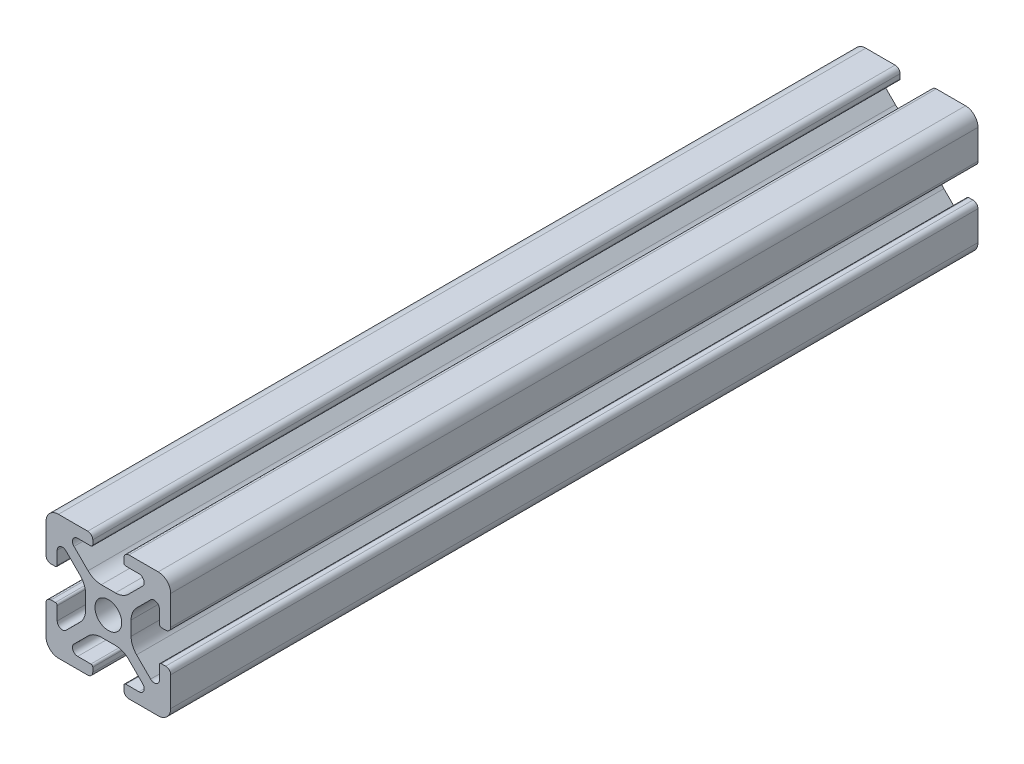
from build123d import *

# Parameters (mm, degrees)
BOSS_EXTRU_1_DEPTH = 129.5


with BuildPart() as part:
    # Esquisse1 → Boss.-Extru.1 (new body)
    with BuildSketch(Plane.XY):
        with BuildLine():
            Line((-3.255887446, 4.528679645), (-5.506192286, 6.778984485))
            ThreePointArc((-5.506192286, 6.778984485), (-5.686636441, 7.686138511), (-4.917588391, 8.199999989))
            Line((-4.917588391, 8.199999989), (-2.799999991, 8.199999989))
            ThreePointArc((-2.799999991, 8.199999989), (-2.587867957, 8.287867955), (-2.499999991, 8.499999989))
            Line((-2.499999991, 8.499999989), (-2.499999991, 9.199999989))
            ThreePointArc((-2.499999991, 9.199999989), (-2.734314566, 9.765685414), (-3.299999991, 9.999999989))
            Line((-3.299999991, 9.999999989), (-7.999999991, 9.999999989))
            ThreePointArc((-7.999999991, 9.999999989), (-9.414213554, 9.414213552), (-9.999999991, 7.999999989))
            Line((-9.999999991, 7.999999989), (-9.999999991, 3.299999989))
            ThreePointArc((-9.999999991, 3.299999989), (-9.765685416, 2.734314564), (-9.199999991, 2.499999989))
            Line((-9.199999991, 2.499999989), (-8.499999991, 2.499999989))
            ThreePointArc((-8.499999991, 2.499999989), (-8.287867957, 2.587867955), (-8.199999991, 2.799999989))
            Line((-8.199999991, 2.799999989), (-8.199999991, 4.917588389))
            ThreePointArc((-8.199999991, 4.917588389), (-7.686138517, 5.686636433), (-6.778984497, 5.506192279))
            Line((-6.778984497, 5.506192279), (-4.528679657, 3.255887439))
            ThreePointArc((-4.528679657, 3.255887439), (-3.878361403, 2.282617393), (-3.650000001, 1.134567096))
            Line((-3.650000001, 1.134567096), (-3.650000001, -1.134567114))
            ThreePointArc((-3.650000001, -1.134567114), (-3.878361403, -2.282617409), (-4.528679656, -3.255887454))
            Line((-4.528679656, -3.255887454), (-6.778984496, -5.506192294))
            ThreePointArc((-6.778984496, -5.506192294), (-7.686138522, -5.686636449), (-8.2, -4.9175884))
            Line((-8.2, -4.9175884), (-8.2, -2.8))
            ThreePointArc((-8.2, -2.8), (-8.287867966, -2.587867966), (-8.5, -2.5))
            Line((-8.5, -2.5), (-9.2, -2.5))
            ThreePointArc((-9.2, -2.5), (-9.765685425, -2.734314575), (-10, -3.3))
            Line((-10, -3.3), (-10, -8))
            ThreePointArc((-10, -8), (-9.414213562, -9.414213562), (-8, -10))
            Line((-8, -10), (-3.3, -10))
            ThreePointArc((-3.3, -10), (-2.734314575, -9.765685425), (-2.5, -9.2))
            Line((-2.5, -9.2), (-2.5, -8.5))
            ThreePointArc((-2.5, -8.5), (-2.587867966, -8.287867966), (-2.8, -8.2))
            Line((-2.8, -8.2), (-4.9175884, -8.2))
            ThreePointArc((-4.9175884, -8.2), (-5.686636444, -7.686138526), (-5.50619229, -6.778984506))
            Line((-5.50619229, -6.778984506), (-3.25588745, -4.528679666))
            ThreePointArc((-3.25588745, -4.528679666), (-2.282617404, -3.878361412), (-1.134567106, -3.650000009))
            Line((-1.134567106, -3.650000009), (1.134567104, -3.650000009))
            ThreePointArc((1.134567104, -3.650000009), (2.282617399, -3.878361412), (3.255887444, -4.528679664))
            Line((3.255887444, -4.528679664), (5.506192284, -6.778984504))
            ThreePointArc((5.506192284, -6.778984504), (5.686636439, -7.686138531), (4.917588389, -8.200000009))
            Line((4.917588389, -8.200000009), (2.799999989, -8.200000009))
            ThreePointArc((2.799999989, -8.200000009), (2.587867955, -8.287867974), (2.499999989, -8.500000009))
            Line((2.499999989, -8.500000009), (2.499999989, -9.200000009))
            ThreePointArc((2.499999989, -9.200000009), (2.734314564, -9.765685434), (3.299999989, -10.000000009))
            Line((3.299999989, -10.000000009), (7.999999989, -10.000000009))
            ThreePointArc((7.999999989, -10.000000009), (9.414213552, -9.414213571), (9.999999989, -8.000000009))
            Line((9.999999989, -8.000000009), (9.999999989, -3.300000009))
            ThreePointArc((9.999999989, -3.300000009), (9.765685414, -2.734314584), (9.199999989, -2.500000009))
            Line((9.199999989, -2.500000009), (8.499999989, -2.500000009))
            ThreePointArc((8.499999989, -2.500000009), (8.287867955, -2.587867974), (8.199999989, -2.800000009))
            Line((8.199999989, -2.800000009), (8.199999989, -4.917588409))
            ThreePointArc((8.199999989, -4.917588409), (7.686138515, -5.686636452), (6.778984495, -5.506192299))
            Line((6.778984495, -5.506192299), (4.528679655, -3.255887459))
            ThreePointArc((4.528679655, -3.255887459), (3.878361401, -2.282617412), (3.649999999, -1.134567115))
            Line((3.649999999, -1.134567115), (3.649999999, 1.134567095))
            ThreePointArc((3.649999999, 1.134567095), (3.878361401, 2.28261739), (4.528679654, 3.255887435))
            Line((4.528679654, 3.255887435), (6.778984494, 5.506192275))
            ThreePointArc((6.778984494, 5.506192275), (7.68613852, 5.68663643), (8.199999998, 4.917588381))
            Line((8.199999998, 4.917588381), (8.199999998, 2.799999981))
            ThreePointArc((8.199999998, 2.799999981), (8.287867964, 2.587867946), (8.499999998, 2.499999981))
            Line((8.499999998, 2.499999981), (9.199999998, 2.499999981))
            ThreePointArc((9.199999998, 2.499999981), (9.765685423, 2.734314556), (9.999999998, 3.299999981))
            Line((9.999999998, 3.299999981), (9.999999998, 7.999999981))
            ThreePointArc((9.999999998, 7.999999981), (9.41421356, 9.414213543), (7.999999998, 9.999999981))
            Line((7.999999998, 9.999999981), (3.299999998, 9.999999981))
            ThreePointArc((3.299999998, 9.999999981), (2.734314573, 9.765685406), (2.499999998, 9.199999981))
            Line((2.499999998, 9.199999981), (2.499999998, 8.499999981))
            ThreePointArc((2.499999998, 8.499999981), (2.587867964, 8.287867946), (2.799999998, 8.199999981))
            Line((2.799999998, 8.199999981), (4.917588398, 8.199999981))
            ThreePointArc((4.917588398, 8.199999981), (5.686636442, 7.686138507), (5.506192288, 6.778984487))
            Line((5.506192288, 6.778984487), (3.255887448, 4.528679647))
            ThreePointArc((3.255887448, 4.528679647), (2.282617402, 3.878361393), (1.134567104, 3.64999999))
            Line((1.134567104, 3.64999999), (-1.134567106, 3.64999999))
            ThreePointArc((-1.134567106, 3.64999999), (-2.282617401, 3.878361392), (-3.255887446, 4.528679645))
        make_face()
        with BuildLine():
            ThreePointArc((-2.15, 0), (0, -2.15), (2.15, 0))
            ThreePointArc((2.15, 0), (0, 2.15), (-2.15, 0))
        make_face(mode=Mode.SUBTRACT)
    extrude(amount=BOSS_EXTRU_1_DEPTH)


solid = part.part
